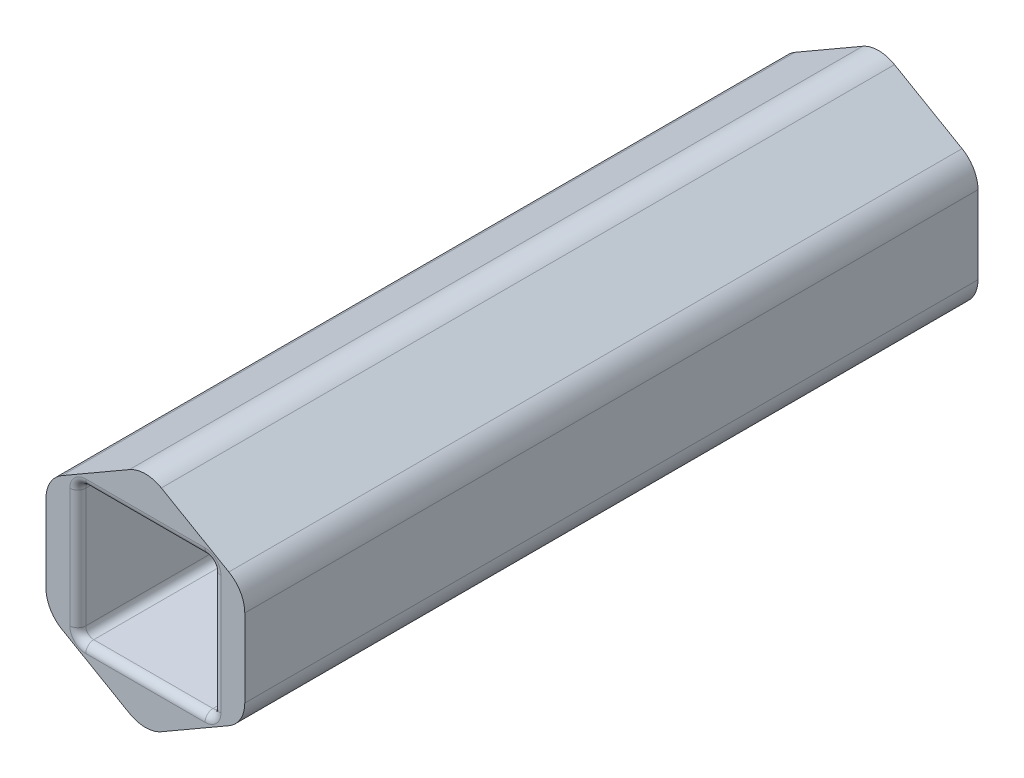
from build123d import *

# Parameters (mm, degrees)
SKETCH1_W           = 6.731
SKETCH1_H           = 6.731
BOSS_EXTRUDE1_DEPTH = 36.5125
FILLET1_R           = 0.396875
FILLET2_R           = 1.5875


with BuildPart() as part:
    # Sketch1 → Boss-Extrude1 (new body)
    with BuildSketch(Plane.XY):
        Polygon((4.949335183, -2.8575), (4.949335183, 2.8575), (0, 5.715), (-4.949335183, 2.8575), (-4.949335183, -2.8575), (0, -5.715), align=None)
        Rectangle(SKETCH1_W, SKETCH1_H, mode=Mode.SUBTRACT)
    extrude(amount=BOSS_EXTRUDE1_DEPTH)

    # Fillet1
    fillet1_edges = [part.edges().sort_by_distance(p)[0] for p in [
        (3.3655, 0, 0),
        (3.3655, -3.3655, 18.25625),
        (0, 3.3655, 0),
        (3.3655, 3.3655, 18.25625),
        (-3.3655, 0, 0),
        (-3.3655, 3.3655, 18.25625),
        (0, -3.3655, 0),
        (-3.3655, -3.3655, 18.25625),
        (3.3655, 0, 36.5125),
        (0, 3.3655, 36.5125),
        (-3.3655, 0, 36.5125),
        (0, -3.3655, 36.5125),
    ]]
    fillet(fillet1_edges, radius=FILLET1_R)

    # Fillet2
    fillet2_edges = [part.edges().sort_by_distance(p)[0] for p in [
        (0, -5.715, 18.25625),
        (-4.949335183, -2.8575, 18.25625),
        (-4.949335183, 2.8575, 18.25625),
        (0, 5.715, 18.25625),
        (4.949335183, 2.8575, 18.25625),
        (4.949335183, -2.8575, 18.25625),
    ]]
    fillet(fillet2_edges, radius=FILLET2_R)


solid = part.part
